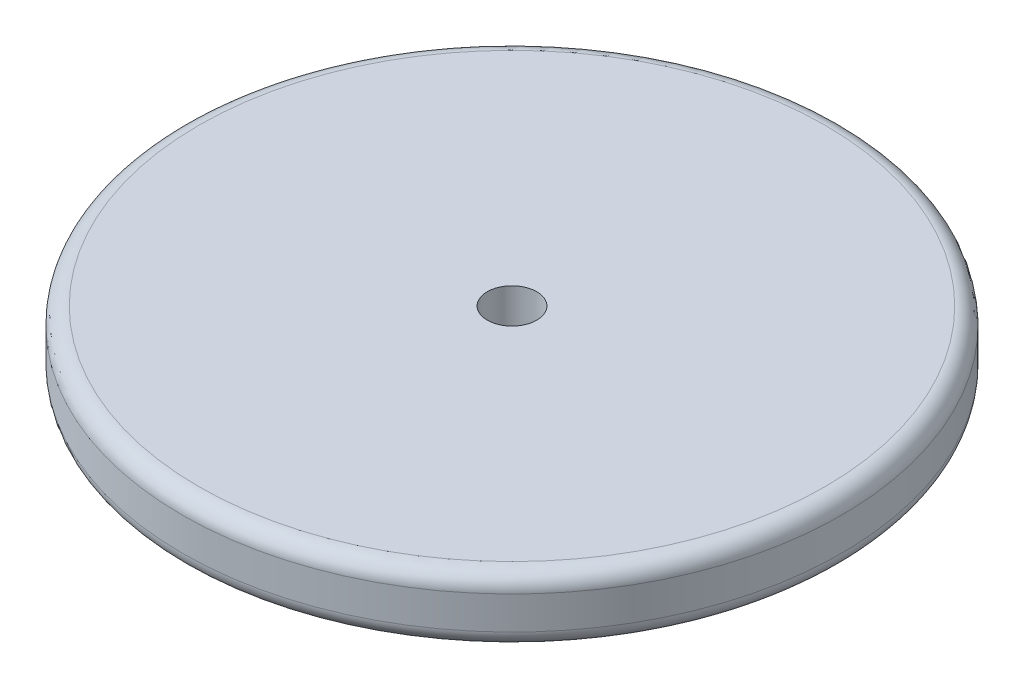
from build123d import *

# Parameters (mm, degrees)
SKETCH_1_R      = 100
SKETCH_1_R_2    = 7.5
EXTRUDE_1_DEPTH = 20
FILLET_1_R      = 5


with BuildPart() as part:
    # 草图1 → 凸台-拉伸1 (new body)
    with BuildSketch(Plane(origin=(0, 0, 0), x_dir=(1, 0, 0), z_dir=(0, 1, 0))):
        with Locations(Location((0, 0, 0), (0, 0, 270))):
            Circle(SKETCH_1_R)
        with Locations(Location((0, 0, 0), (0, 0, 270))):
            Circle(SKETCH_1_R_2, mode=Mode.SUBTRACT)
    extrude(amount=EXTRUDE_1_DEPTH)

    # 圆角1
    fillet_1_edges = [part.edges().sort_by_distance(p)[0] for p in [
        (0, 0, -100),
        (0, 20, -100),
    ]]
    fillet(fillet_1_edges, radius=FILLET_1_R)


solid = part.part
